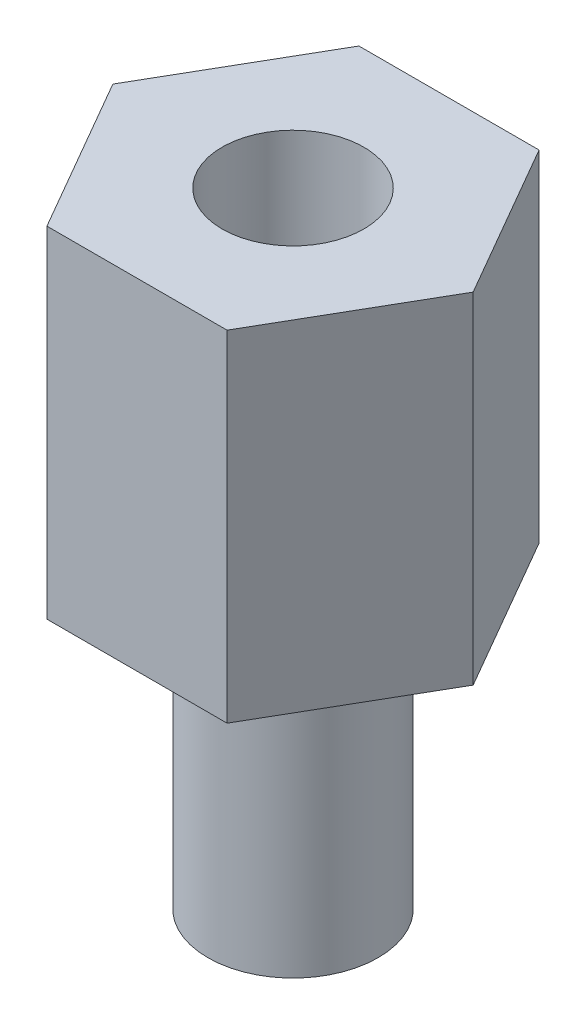
from build123d import *

# Parameters (mm, degrees)
BOSS_EXTRUDE1_DEPTH       = 6
SKETCH2_R                 = 1.5
BOSS_EXTRUDE2_DEPTH       = 5
M3X0_5_TAPPED_HOLE1_D     = 2.5
M3X0_5_TAPPED_HOLE1_DEPTH = 5.5
M3X0_5_TAPPED_HOLE1_TIP   = 0.751075774


with BuildPart() as part:
    # Sketch1 → Boss-Extrude1 (new body)
    with BuildSketch(Plane(origin=(0, 0, 0), x_dir=(1, 0, 0), z_dir=(0, 1, 0))):
        Polygon((1.58771324, 2.75), (-1.58771324, 2.75), (-3.175426481, 0), (-1.58771324, -2.75), (1.58771324, -2.75), (3.175426481, 0), align=None)
    extrude(amount=BOSS_EXTRUDE1_DEPTH)

    # Sketch2 → Boss-Extrude2 (add)
    with BuildSketch(Plane.XZ):
        with Locations(Location((0, 0, 0), (0, 0, 90))):
            Circle(SKETCH2_R)
    extrude(amount=BOSS_EXTRUDE2_DEPTH)

    # M3x0.5 Tapped Hole1
    with Locations(Plane(origin=(0, 6, 0), x_dir=(1, 0, 0), z_dir=(0, 1, 0))):
        with Locations((0, 0)):
            Hole(M3X0_5_TAPPED_HOLE1_D / 2, depth=M3X0_5_TAPPED_HOLE1_DEPTH)
            with Locations((0, 0, -(M3X0_5_TAPPED_HOLE1_DEPTH + M3X0_5_TAPPED_HOLE1_TIP / 2))):  # 118° drill point
                Cone(0, M3X0_5_TAPPED_HOLE1_D / 2, M3X0_5_TAPPED_HOLE1_TIP, mode=Mode.SUBTRACT)


solid = part.part
